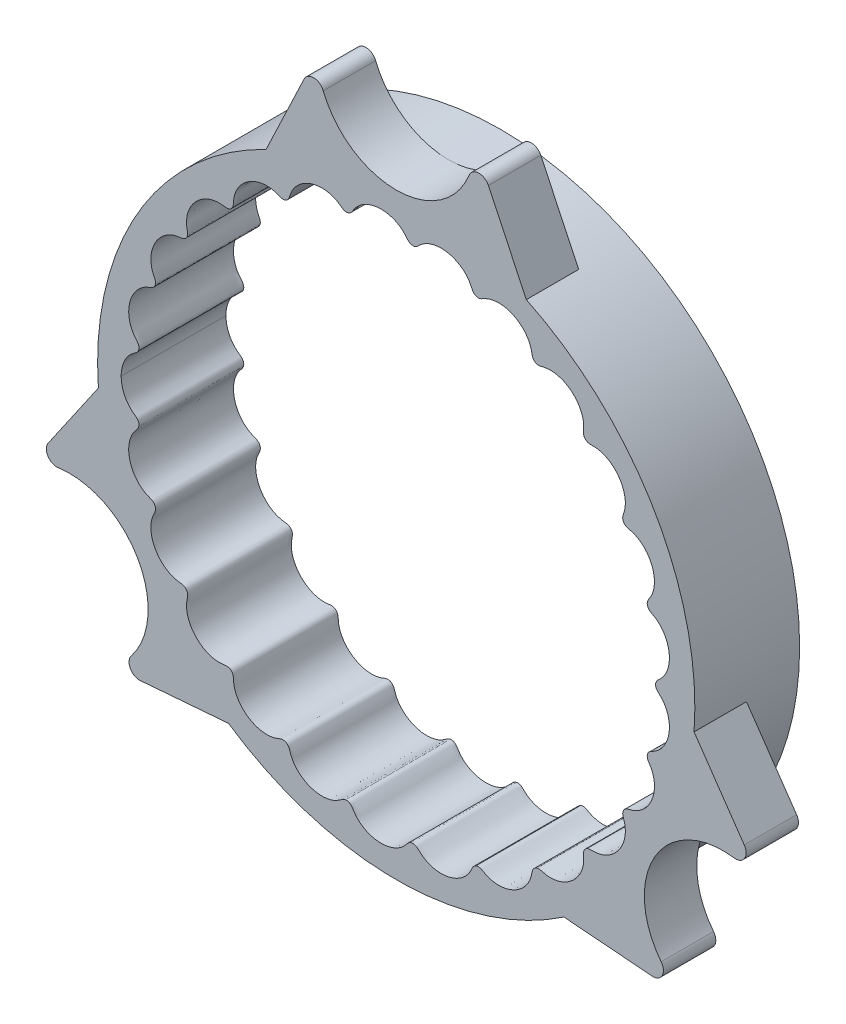
from build123d import *

# Parameters (mm, degrees)
ESQUISSE1_R        = 28.5
BOSS_EXTRU_1_DEPTH = 10
BOSS_EXTRU_2_START = -5
BOSS_EXTRU_2_DEPTH = 5


with BuildPart() as part:
    # Esquisse1 → Boss.-Extru.1 (new body)
    with BuildSketch(Plane.XY):
        Circle(ESQUISSE1_R)
        with BuildLine():
            add(Edge.make_bspline(
                [(24.75, 0), (24.75, -0.01190895), (24.750668659, -0.029768799), (24.75289752, -0.060006713), (24.758884934, -0.104774168), (24.767485304, -0.1467503), (24.785152354, -0.206071411), (24.818482478, -0.284185867), (24.880818803, -0.385919884), (24.984658612, -0.50047292), (25.114781066, -0.616600782), (25.255435339, -0.752464933), (25.419807145, -0.93333087), (25.594989864, -1.169106201), (25.768920192, -1.472936072), (25.920736133, -1.849650866), (26.023477253, -2.249860974), (26.074696747, -2.666946621), (26.073312156, -3.086313852), (26.020370658, -3.501501101), (25.917002683, -3.906273732), (25.764403676, -4.294347485), (25.566224565, -4.654785317), (25.325903213, -4.981499954), (25.081588671, -5.233067427), (24.851914535, -5.418631885), (24.667098284, -5.540217829), (24.539548747, -5.613941762), (24.410179088, -5.684594723), (24.273991814, -5.758046627), (24.120002912, -5.867762768), (23.989867, -6.050335584), (23.936355638, -6.275127193), (23.969192195, -6.495758333), (24.065351302, -6.684284012), (24.178449314, -6.851934675), (24.280144364, -7.019011908), (24.393570042, -7.235347013), (24.503436737, -7.50770452), (24.595094748, -7.84543671), (24.647032867, -8.248159789), (24.645694803, -8.661209862), (24.57595365, -9.185528563), (24.417645445, -9.696077248), (24.174741138, -10.176578568), (23.852030812, -10.610062282), (23.558837347, -10.90980476), (23.24095056, -11.157802847), (22.946586259, -11.329086722), (22.692113519, -11.440823192), (22.472657763, -11.513539342), (22.29388462, -11.561503733), (22.101259895, -11.606028638), (21.902055354, -11.681610724), (21.728453668, -11.828148656), (21.620885016, -12.038837081), (21.601595838, -12.263660858), (21.650481834, -12.469316746), (21.718254479, -12.659791435), (21.774584138, -12.84705718), (21.829677768, -13.084963879), (21.867201208, -13.376160202), (21.870688906, -13.725995236), (21.819474916, -14.128698884), (21.71419458, -14.527993453), (21.514773646, -15.017801417), (21.233133123, -15.4720736), (20.877140734, -15.876030958), (20.455657215, -16.214386724), (20.096354081, -16.430676116), (19.726170583, -16.590569736), (19.398076252, -16.68206281), (19.123633935, -16.725922166), (18.892914818, -16.74091163), (18.707848134, -16.742350192), (18.510091067, -16.737829569), (18.298399992, -16.764443666), (18.095471353, -16.866909122), (17.942147178, -17.047179332), (17.871387572, -17.261366287), (17.870202468, -17.472525416), (17.888313355, -17.673814374), (17.895669209, -17.869207586), (17.888886536, -18.113260777), (17.85168272, -18.404436203), (17.766823301, -18.743754438), (17.615819616, -19.120463832), (17.413434594, -19.48028858), (17.162321288, -19.816819375), (16.868500143, -20.122110223), (16.535786091, -20.390797243), (16.168397966, -20.617282366), (15.771042449, -20.795687849), (15.368766607, -20.914546396), (14.97017149, -20.975982916), (14.629556137, -20.981746846), (14.352921577, -20.954877105), (14.125857036, -20.911170138), (13.94640051, -20.866001244), (13.755772511, -20.812781493), (13.543469889, -20.788894817), (13.322238716, -20.84166807), (13.131407642, -20.981742865), (13.0130413, -21.173627181), (12.961818542, -21.378246364), (12.929064797, -21.57761534), (12.886990745, -21.768547341), (12.818791692, -22.002934942), (12.70930802, -22.275243379), (12.541628211, -22.582120244), (12.300626204, -22.908551746), (12.01422203, -23.205749325), (11.686582401, -23.4681837), (11.325453487, -23.689705246), (10.935854532, -23.866053147), (10.523258626, -23.992837457), (10.093696991, -24.06550579), (9.674368845, -24.079231972), (9.273085465, -24.038208914), (8.941983123, -23.957846351), (8.681067639, -23.861969077), (8.472360468, -23.762392874), (8.310008249, -23.673519219), (8.138322101, -23.574972467), (7.937182673, -23.501849574), (7.704899941, -23.502076627), (7.478095746, -23.600741865), (7.316947907, -23.77285878), (7.220831609, -23.97055906), (7.115634845, -24.203403783), (6.974300377, -24.460401189), (6.773045478, -24.737487424), (6.497851462, -25.02237666), (6.183428844, -25.270910892), (5.835740341, -25.479668636), (5.460328709, -25.645214949), (5.061542815, -25.765601822), (4.644666369, -25.83709061), (4.215744672, -25.855893135), (3.781608585, -25.818103671), (3.372294549, -25.725760832), (2.994169108, -25.584908149), (2.694109042, -25.423555897), (2.465647641, -25.264915254), (2.289085947, -25.115815571), (2.153739497, -24.989104422), (2.012318186, -24.851122457), (1.832423714, -24.733108156), (1.552983355, -24.66593755), (1.26214529, -24.754622086), (1.075414287, -24.957557798), (0.889090341, -25.194134228), (0.69672049, -25.401829912), (0.44758856, -25.61527269), (0.125683965, -25.821812182), (-0.224585626, -25.987068298), (-0.598975616, -26.109092558), (-0.990876156, -26.185347308), (-1.391941275, -26.2145582), (-1.796224618, -26.195837186), (-2.198144681, -26.128499562), (-2.591457519, -26.011923113), (-2.962803429, -25.848997421), (-3.306221845, -25.642423994), (-3.61537583, -25.39483403), (-3.850272783, -25.145621471), (-4.023133112, -24.908691884), (-4.156981332, -24.691054937), (-4.276293257, -24.506578487), (-4.456318725, -24.354528199), (-4.693068775, -24.282897531), (-4.923798246, -24.309710303), (-5.115035952, -24.406102337), (-5.273240645, -24.525178417), (-5.42301226, -24.633920894), (-5.617383402, -24.75923363), (-5.863981708, -24.887558689), (-6.182207181, -25.009385657), (-6.575059912, -25.101071531), (-6.9927825, -25.140689035), (-7.428136381, -25.123106217), (-7.851204623, -25.050059218), (-8.255644199, -24.926289526), (-8.635975215, -24.756290763), (-8.987390026, -24.544434268), (-9.305810055, -24.293211507), (-9.586131065, -24.006734367), (-9.822904508, -23.689158592), (-9.987239236, -23.388704672), (-10.094751199, -23.11580793), (-10.169610451, -22.871508954), (-10.24112571, -22.663502872), (-10.381175345, -22.473662137), (-10.594956363, -22.349311543), (-10.825624608, -22.322047042), (-11.033849204, -22.370890621), (-11.216381876, -22.447371753), (-11.388695767, -22.514940651), (-11.608352834, -22.58716666), (-11.87933894, -22.649041617), (-12.217942215, -22.68664221), (-12.621151131, -22.6763477), (-13.035301253, -22.609509201), (-13.452127793, -22.482943679), (-13.845292771, -22.304868342), (-14.20938889, -22.080540487), (-14.539531306, -21.814993299), (-14.831269767, -21.513076759), (-15.077661765, -21.181891436), (-15.275270226, -20.827454377), (-15.402577207, -20.501715906), (-15.476526159, -20.217667398), (-15.514326563, -19.976485954), (-15.531829272, -19.781749163), (-15.539202372, -19.579813227), (-15.565591069, -19.370421028), (-15.660806856, -19.1659885), (-15.83405536, -19.004717982), (-16.047591105, -18.926560558), (-16.261088064, -18.925182163), (-16.456798489, -18.954287053), (-16.640543184, -18.976331541), (-16.871307425, -18.990807395), (-17.149104778, -18.982241272), (-17.486194881, -18.933211709), (-17.873723074, -18.821638459), (-18.257615968, -18.652692803), (-18.629084532, -18.425342732), (-18.964764813, -18.15411038), (-19.260725449, -17.845401443), (-19.513475385, -17.50529118), (-19.719894943, -17.139574851), (-19.874988153, -16.756923442), (-19.976929286, -16.364037242), (-20.017953734, -16.016642642), (-20.017798024, -15.723070973), (-19.993447495, -15.480115157), (-19.96134753, -15.287225434), (-19.918054975, -15.089779832), (-19.89402871, -14.879875268), (-19.939362883, -14.658860507), (-20.070693635, -14.462043286), (-20.260249499, -14.336679591), (-20.467155514, -14.285214031), (-20.663881817, -14.2650629), (-20.847282484, -14.240161779), (-21.074211831, -14.195950386), (-21.340836688, -14.11751373), (-21.654611423, -13.985047804), (-22.001454707, -13.779432555), (-22.330360371, -13.519308084), (-22.705485211, -13.130240844), (-23.007369545, -12.684411231), (-23.229136266, -12.198075036), (-23.364819327, -11.686883469), (-23.418570267, -11.277399868), (-23.418213213, -10.871399708), (-23.370257339, -10.524800668), (-23.295965049, -10.240716159), (-23.211017087, -10.011726748), (-23.131365089, -9.833119484), (-23.040198426, -9.652618084), (-22.96715924, -9.454144986), (-22.960141523, -9.228680333), (-23.042373084, -9.007208297), (-23.198166311, -8.840665724), (-23.388940312, -8.741382585), (-23.57769294, -8.6722803), (-23.75308195, -8.599853942), (-23.966244513, -8.496298837), (-24.209343816, -8.347711506), (-24.48032477, -8.1355972), (-24.761295108, -7.846344695), (-25.008480075, -7.513349868), (-25.26655565, -7.04900195), (-25.442920247, -6.54763643), (-25.533949151, -6.025561479), (-25.536599067, -5.498854498), (-25.485486947, -5.088916426), (-25.382794666, -4.696000106), (-25.248906316, -4.372612425), (-25.105242941, -4.116427211), (-24.965170858, -3.916248887), (-24.843083512, -3.763442502), (-24.709834093, -3.611215538), (-24.591948067, -3.435387495), (-24.533798882, -3.220620895), (-24.560423715, -2.992589013), (-24.66665443, -2.797016304), (-24.822727104, -2.653701408), (-24.98966356, -2.53926073), (-25.146322188, -2.422077132), (-25.332496393, -2.263776399), (-25.502275925, -2.087254142), (-25.654526877, -1.895838833), (-25.79052351, -1.688263992), (-25.890012472, -1.511998867), (-25.978955887, -1.325507929), (-26.056614781, -1.131467198), (-26.121383307, -0.930707527), (-26.173241314, -0.729759288), (-26.207287779, -0.545661218), (-26.228372118, -0.39585777), (-26.240536879, -0.255725402), (-26.247025958, -0.16909655), (-26.249459241, -0.066739393), (-26.25, -0.022255367), (-26.25, 0)],
                knots=[0.07432085, 0.07432085, 0.07432085, 0.07432085, 0.07432085, 0.074838236, 0.075096929, 0.075355622, 0.075873009, 0.076390395, 0.077425167, 0.07845994, 0.080262761, 0.082065582, 0.083868403, 0.085671224, 0.089276866, 0.092882508, 0.096749545, 0.100616583, 0.104483621, 0.108350658, 0.112188336, 0.116026013, 0.11986369, 0.123701367, 0.12732655, 0.130951733, 0.132764324, 0.134576916, 0.135483211, 0.136389507, 0.138202099, 0.140295775, 0.142389451, 0.144458848, 0.146528245, 0.148330503, 0.150132762, 0.15193502, 0.153737278, 0.157341795, 0.160946311, 0.164812321, 0.16867833, 0.17254434, 0.180415799, 0.184421248, 0.188426697, 0.192432147, 0.195844027, 0.199255907, 0.200961848, 0.202667788, 0.204373728, 0.206079668, 0.208268892, 0.210458115, 0.21252702, 0.214595925, 0.216397713, 0.218199501, 0.220001289, 0.221803077, 0.225406654, 0.22901023, 0.232875219, 0.236740209, 0.240605199, 0.248476586, 0.252482983, 0.25648938, 0.260495777, 0.263907756, 0.267319735, 0.269025725, 0.270731714, 0.272437704, 0.274143693, 0.276335152, 0.278526612, 0.280594702, 0.282662792, 0.284464203, 0.286265613, 0.288067024, 0.289868435, 0.293471257, 0.297074079, 0.300938067, 0.304802055, 0.308666044, 0.312530032, 0.316537343, 0.320544653, 0.324551964, 0.328559274, 0.331971493, 0.335383713, 0.337089822, 0.338795932, 0.340502041, 0.342208151, 0.3444015, 0.346594848, 0.348661829, 0.35072881, 0.352529935, 0.354331061, 0.356132186, 0.357933311, 0.361535562, 0.365137813, 0.369000829, 0.372863844, 0.37672686, 0.380589876, 0.384598055, 0.388606234, 0.392614413, 0.396622592, 0.400035189, 0.403447785, 0.405154083, 0.406860381, 0.408566679, 0.410272977, 0.412467856, 0.414662735, 0.416905332, 0.41914793, 0.420947533, 0.422747136, 0.426346341, 0.429945547, 0.433544752, 0.437320979, 0.441097206, 0.444873433, 0.44864966, 0.452658654, 0.456667648, 0.460676642, 0.464685636, 0.468098738, 0.471511839, 0.473218389, 0.47492494, 0.476631491, 0.478338041, 0.480534086, 0.48273013, 0.487019518, 0.488748834, 0.49047815, 0.493936782, 0.497395414, 0.500854047, 0.504530334, 0.508206621, 0.511882908, 0.515559195, 0.519334982, 0.52311077, 0.526886557, 0.530662345, 0.534261527, 0.537860709, 0.541459892, 0.543259483, 0.545059074, 0.547300663, 0.549542252, 0.55173776, 0.553933267, 0.555639684, 0.5573461, 0.559052517, 0.560758933, 0.564171767, 0.5675846, 0.571593194, 0.575601788, 0.579610382, 0.583618976, 0.587395654, 0.591172332, 0.594949011, 0.598725689, 0.602324954, 0.605924219, 0.609523484, 0.611323117, 0.613122749, 0.615366313, 0.617609877, 0.619804036, 0.621998195, 0.623704391, 0.625410586, 0.627116782, 0.628822977, 0.632235368, 0.635647759, 0.63965551, 0.643663261, 0.647671012, 0.651678763, 0.655542261, 0.659405759, 0.663269257, 0.667132755, 0.670735268, 0.674337782, 0.676139039, 0.677940295, 0.679741552, 0.681542809, 0.683610379, 0.685677949, 0.687870397, 0.690062845, 0.691768886, 0.693474927, 0.695180968, 0.696887009, 0.700299091, 0.703711172, 0.707718031, 0.71172489, 0.715731748, 0.719738607, 0.723603093, 0.727467579, 0.731332066, 0.735196552, 0.738799727, 0.742402903, 0.744204491, 0.746006079, 0.747807667, 0.749609255, 0.751677791, 0.753746327, 0.755936711, 0.758127095, 0.75983305, 0.761539006, 0.763244962, 0.764950918, 0.76836283, 0.771774741, 0.775780668, 0.779786595, 0.783792522, 0.791663947, 0.795529445, 0.799394943, 0.803260441, 0.806864464, 0.810468487, 0.812270499, 0.81407251, 0.815874522, 0.817676533, 0.819745726, 0.821814919, 0.823998833, 0.826182748, 0.827931402, 0.829680057, 0.831428712, 0.833177366, 0.836674676, 0.840171985, 0.844093542, 0.8480151, 0.851936657, 0.859724738, 0.863591261, 0.867457784, 0.871324307, 0.874929364, 0.87853442, 0.880336948, 0.882139476, 0.883942004, 0.885744532, 0.887814048, 0.889883563, 0.891953048, 0.894022532, 0.895825669, 0.897628805, 0.899431941, 0.901235078, 0.90484135, 0.906644487, 0.908447623, 0.910381399, 0.912315175, 0.914248951, 0.916182727, 0.918116503, 0.920050278, 0.921017166, 0.921984054, 0.922950942, 0.92391783, 0.92391783, 0.92391783, 0.92391783, 0.92391783], degree=4))
            add(Edge.make_bspline(
                [(24.75, 0), (24.75, 0.01190895), (24.750668659, 0.029768799), (24.75289752, 0.060006713), (24.758884934, 0.104774168), (24.767485304, 0.1467503), (24.785152354, 0.206071411), (24.818482478, 0.284185867), (24.880818803, 0.385919884), (24.984658612, 0.50047292), (25.114781066, 0.616600782), (25.255435339, 0.752464933), (25.419807145, 0.93333087), (25.594989864, 1.169106201), (25.768920192, 1.472936072), (25.920736133, 1.849650866), (26.023477253, 2.249860974), (26.074696747, 2.666946621), (26.073312156, 3.086313852), (26.020370658, 3.501501101), (25.917002683, 3.906273732), (25.764403676, 4.294347485), (25.566224565, 4.654785317), (25.325903213, 4.981499954), (25.081588671, 5.233067427), (24.851914535, 5.418631885), (24.667098284, 5.540217829), (24.539548747, 5.613941762), (24.410179088, 5.684594723), (24.273991814, 5.758046627), (24.120002912, 5.867762768), (23.989867, 6.050335584), (23.936355638, 6.275127193), (23.969192195, 6.495758333), (24.065351302, 6.684284012), (24.178449314, 6.851934675), (24.280144364, 7.019011908), (24.393570042, 7.235347013), (24.503436737, 7.50770452), (24.595094748, 7.84543671), (24.647032867, 8.248159789), (24.645694803, 8.661209862), (24.57595365, 9.185528563), (24.417645445, 9.696077248), (24.174741138, 10.176578568), (23.852030812, 10.610062282), (23.558837347, 10.90980476), (23.24095056, 11.157802847), (22.946586259, 11.329086722), (22.692113519, 11.440823192), (22.472657763, 11.513539342), (22.29388462, 11.561503733), (22.101259895, 11.606028638), (21.902055354, 11.681610724), (21.728453668, 11.828148656), (21.620885016, 12.038837081), (21.601595838, 12.263660858), (21.650481834, 12.469316746), (21.718254479, 12.659791435), (21.774584138, 12.84705718), (21.829677768, 13.084963879), (21.867201208, 13.376160202), (21.870688906, 13.725995236), (21.819474916, 14.128698884), (21.71419458, 14.527993453), (21.514773646, 15.017801417), (21.233133123, 15.4720736), (20.877140734, 15.876030958), (20.455657215, 16.214386724), (20.096354081, 16.430676116), (19.726170583, 16.590569736), (19.398076252, 16.68206281), (19.123633935, 16.725922166), (18.892914818, 16.74091163), (18.707848134, 16.742350192), (18.510091067, 16.737829569), (18.298399992, 16.764443666), (18.095471353, 16.866909122), (17.942147178, 17.047179332), (17.871387572, 17.261366287), (17.870202468, 17.472525416), (17.888313355, 17.673814374), (17.895669209, 17.869207586), (17.888886536, 18.113260777), (17.85168272, 18.404436203), (17.766823301, 18.743754438), (17.615819616, 19.120463832), (17.413434594, 19.48028858), (17.162321288, 19.816819375), (16.868500143, 20.122110223), (16.535786091, 20.390797243), (16.168397966, 20.617282366), (15.771042449, 20.795687849), (15.368766607, 20.914546396), (14.97017149, 20.975982916), (14.629556137, 20.981746846), (14.352921577, 20.954877105), (14.125857036, 20.911170138), (13.94640051, 20.866001244), (13.755772511, 20.812781493), (13.543469889, 20.788894817), (13.322238716, 20.84166807), (13.131407642, 20.981742865), (13.0130413, 21.173627181), (12.961818542, 21.378246364), (12.929064797, 21.57761534), (12.886990745, 21.768547341), (12.818791692, 22.002934942), (12.70930802, 22.275243379), (12.541628211, 22.582120244), (12.300626204, 22.908551746), (12.01422203, 23.205749325), (11.686582401, 23.4681837), (11.325453487, 23.689705246), (10.935854532, 23.866053147), (10.523258626, 23.992837457), (10.093696991, 24.06550579), (9.674368845, 24.079231972), (9.273085465, 24.038208914), (8.941983123, 23.957846351), (8.681067639, 23.861969077), (8.472360468, 23.762392874), (8.310008249, 23.673519219), (8.138322101, 23.574972467), (7.937182673, 23.501849574), (7.704899941, 23.502076627), (7.478095746, 23.600741865), (7.316947907, 23.772858779), (7.220831609, 23.97055906), (7.115634845, 24.203403783), (6.974300377, 24.460401189), (6.773045477, 24.737487424), (6.497851462, 25.02237666), (6.183428844, 25.270910892), (5.835740341, 25.479668636), (5.460328709, 25.645214949), (5.061542815, 25.765601822), (4.644666369, 25.83709061), (4.215744672, 25.855893135), (3.781608585, 25.818103671), (3.372294549, 25.725760832), (2.994169108, 25.584908149), (2.694109042, 25.423555897), (2.465647641, 25.264915254), (2.289085947, 25.115815571), (2.153739497, 24.989104422), (2.012318186, 24.851122457), (1.832423714, 24.733108156), (1.552983354, 24.66593755), (1.26214529, 24.754622086), (1.075414287, 24.957557798), (0.889090341, 25.194134228), (0.69672049, 25.401829912), (0.44758856, 25.61527269), (0.125683965, 25.821812182), (-0.224585626, 25.987068298), (-0.598975616, 26.109092558), (-0.990876156, 26.185347308), (-1.391941275, 26.2145582), (-1.796224618, 26.195837186), (-2.198144681, 26.128499562), (-2.591457519, 26.011923113), (-2.962803429, 25.848997421), (-3.306221845, 25.642423994), (-3.61537583, 25.39483403), (-3.850272783, 25.145621471), (-4.023133112, 24.908691884), (-4.156981332, 24.691054937), (-4.276293257, 24.506578487), (-4.456318725, 24.354528199), (-4.693068775, 24.282897531), (-4.923798246, 24.309710303), (-5.115035952, 24.406102337), (-5.273240646, 24.525178417), (-5.42301226, 24.633920894), (-5.617383402, 24.75923363), (-5.863981708, 24.887558689), (-6.182207181, 25.009385657), (-6.575059912, 25.101071531), (-6.9927825, 25.140689035), (-7.428136381, 25.123106217), (-7.851204623, 25.050059218), (-8.255644199, 24.926289526), (-8.635975215, 24.756290763), (-8.987390026, 24.544434268), (-9.305810055, 24.293211507), (-9.586131065, 24.006734367), (-9.822904508, 23.689158592), (-9.987239236, 23.388704672), (-10.094751199, 23.11580793), (-10.169610451, 22.871508954), (-10.24112571, 22.663502872), (-10.381175345, 22.473662137), (-10.594956363, 22.349311543), (-10.825624608, 22.322047042), (-11.033849204, 22.370890621), (-11.216381876, 22.447371753), (-11.388695767, 22.514940651), (-11.608352834, 22.58716666), (-11.87933894, 22.649041617), (-12.217942215, 22.68664221), (-12.621151131, 22.676347699), (-13.035301253, 22.609509201), (-13.452127793, 22.482943679), (-13.845292771, 22.304868342), (-14.20938889, 22.080540487), (-14.539531306, 21.814993299), (-14.831269767, 21.513076759), (-15.077661765, 21.181891436), (-15.275270226, 20.827454377), (-15.402577207, 20.501715906), (-15.476526159, 20.217667398), (-15.514326563, 19.976485954), (-15.531829272, 19.781749163), (-15.539202372, 19.579813227), (-15.565591069, 19.370421028), (-15.660806856, 19.1659885), (-15.83405536, 19.004717982), (-16.047591105, 18.926560558), (-16.261088064, 18.925182163), (-16.456798489, 18.954287053), (-16.640543184, 18.976331541), (-16.871307425, 18.990807395), (-17.149104778, 18.982241272), (-17.486194881, 18.933211709), (-17.873723074, 18.821638459), (-18.257615968, 18.652692802), (-18.629084532, 18.425342732), (-18.964764813, 18.15411038), (-19.260725449, 17.845401443), (-19.513475385, 17.50529118), (-19.719894943, 17.139574851), (-19.874988153, 16.756923442), (-19.976929286, 16.364037242), (-20.017953734, 16.016642642), (-20.017798024, 15.723070973), (-19.993447495, 15.480115157), (-19.96134753, 15.287225434), (-19.918054975, 15.089779832), (-19.89402871, 14.879875268), (-19.939362883, 14.658860507), (-20.070693635, 14.462043286), (-20.260249499, 14.336679591), (-20.467155514, 14.285214031), (-20.663881817, 14.2650629), (-20.847282484, 14.240161779), (-21.074211831, 14.195950386), (-21.340836688, 14.11751373), (-21.654611423, 13.985047804), (-22.001454707, 13.779432555), (-22.330360371, 13.519308084), (-22.705485211, 13.130240844), (-23.007369545, 12.684411231), (-23.229136266, 12.198075036), (-23.364819327, 11.686883469), (-23.418570267, 11.277399868), (-23.418213213, 10.871399708), (-23.370257339, 10.524800667), (-23.295965049, 10.240716159), (-23.211017087, 10.011726748), (-23.131365089, 9.833119484), (-23.040198426, 9.652618084), (-22.96715924, 9.454144986), (-22.960141523, 9.228680333), (-23.042373084, 9.007208297), (-23.198166311, 8.840665724), (-23.388940312, 8.741382585), (-23.57769294, 8.6722803), (-23.75308195, 8.599853942), (-23.966244513, 8.496298837), (-24.209343816, 8.347711506), (-24.48032477, 8.1355972), (-24.761295108, 7.846344695), (-25.008480075, 7.513349868), (-25.26655565, 7.04900195), (-25.442920247, 6.54763643), (-25.533949151, 6.025561479), (-25.536599067, 5.498854498), (-25.485486947, 5.088916426), (-25.382794666, 4.696000106), (-25.248906316, 4.372612425), (-25.105242941, 4.116427211), (-24.965170858, 3.916248887), (-24.843083512, 3.763442502), (-24.709834093, 3.611215538), (-24.591948067, 3.435387495), (-24.533798882, 3.220620895), (-24.560423715, 2.992589013), (-24.66665443, 2.797016303), (-24.822727104, 2.653701408), (-24.98966356, 2.53926073), (-25.146322188, 2.422077132), (-25.332496393, 2.263776399), (-25.502275925, 2.087254142), (-25.654526877, 1.895838833), (-25.79052351, 1.688263992), (-25.890012472, 1.511998867), (-25.978955887, 1.325507929), (-26.056614781, 1.131467198), (-26.121383307, 0.930707527), (-26.173241314, 0.729759288), (-26.207287779, 0.545661218), (-26.228372118, 0.39585777), (-26.240536879, 0.255725402), (-26.247025958, 0.16909655), (-26.249459241, 0.066739393), (-26.25, 0.022255367), (-26.25, 0)],
                knots=[0.07432085, 0.07432085, 0.07432085, 0.07432085, 0.07432085, 0.074838236, 0.075096929, 0.075355622, 0.075873009, 0.076390395, 0.077425167, 0.07845994, 0.080262761, 0.082065582, 0.083868403, 0.085671224, 0.089276866, 0.092882508, 0.096749545, 0.100616583, 0.104483621, 0.108350658, 0.112188336, 0.116026013, 0.11986369, 0.123701367, 0.12732655, 0.130951733, 0.132764324, 0.134576916, 0.135483211, 0.136389507, 0.138202099, 0.140295775, 0.142389451, 0.144458848, 0.146528245, 0.148330503, 0.150132762, 0.15193502, 0.153737278, 0.157341795, 0.160946311, 0.164812321, 0.16867833, 0.17254434, 0.180415799, 0.184421248, 0.188426697, 0.192432147, 0.195844027, 0.199255907, 0.200961848, 0.202667788, 0.204373728, 0.206079668, 0.208268892, 0.210458115, 0.21252702, 0.214595925, 0.216397713, 0.218199501, 0.220001289, 0.221803077, 0.225406654, 0.22901023, 0.232875219, 0.236740209, 0.240605199, 0.248476586, 0.252482983, 0.25648938, 0.260495777, 0.263907756, 0.267319735, 0.269025725, 0.270731714, 0.272437704, 0.274143693, 0.276335152, 0.278526612, 0.280594702, 0.282662792, 0.284464203, 0.286265613, 0.288067024, 0.289868435, 0.293471257, 0.297074079, 0.300938067, 0.304802055, 0.308666044, 0.312530032, 0.316537343, 0.320544653, 0.324551964, 0.328559274, 0.331971493, 0.335383713, 0.337089822, 0.338795932, 0.340502041, 0.342208151, 0.3444015, 0.346594848, 0.348661829, 0.35072881, 0.352529935, 0.354331061, 0.356132186, 0.357933311, 0.361535562, 0.365137813, 0.369000829, 0.372863844, 0.37672686, 0.380589876, 0.384598055, 0.388606234, 0.392614413, 0.396622592, 0.400035189, 0.403447785, 0.405154083, 0.406860381, 0.408566679, 0.410272977, 0.412467856, 0.414662735, 0.416905332, 0.41914793, 0.420947533, 0.422747136, 0.426346341, 0.429945547, 0.433544752, 0.437320979, 0.441097206, 0.444873433, 0.44864966, 0.452658654, 0.456667648, 0.460676642, 0.464685636, 0.468098738, 0.471511839, 0.473218389, 0.47492494, 0.476631491, 0.478338041, 0.480534086, 0.48273013, 0.487019518, 0.488748834, 0.49047815, 0.493936782, 0.497395414, 0.500854047, 0.504530334, 0.508206621, 0.511882908, 0.515559195, 0.519334982, 0.52311077, 0.526886557, 0.530662345, 0.534261527, 0.537860709, 0.541459892, 0.543259483, 0.545059074, 0.547300663, 0.549542252, 0.55173776, 0.553933267, 0.555639684, 0.5573461, 0.559052517, 0.560758933, 0.564171767, 0.5675846, 0.571593194, 0.575601788, 0.579610382, 0.583618976, 0.587395654, 0.591172332, 0.594949011, 0.598725689, 0.602324954, 0.605924219, 0.609523484, 0.611323117, 0.613122749, 0.615366313, 0.617609877, 0.619804036, 0.621998195, 0.623704391, 0.625410586, 0.627116782, 0.628822977, 0.632235368, 0.635647759, 0.63965551, 0.643663261, 0.647671012, 0.651678763, 0.655542261, 0.659405759, 0.663269257, 0.667132755, 0.670735268, 0.674337782, 0.676139039, 0.677940295, 0.679741552, 0.681542809, 0.683610379, 0.685677949, 0.687870397, 0.690062845, 0.691768886, 0.693474927, 0.695180968, 0.696887009, 0.700299091, 0.703711172, 0.707718031, 0.71172489, 0.715731748, 0.719738607, 0.723603093, 0.727467579, 0.731332066, 0.735196552, 0.738799727, 0.742402903, 0.744204491, 0.746006079, 0.747807667, 0.749609255, 0.751677791, 0.753746327, 0.755936711, 0.758127095, 0.75983305, 0.761539006, 0.763244962, 0.764950918, 0.76836283, 0.771774741, 0.775780668, 0.779786595, 0.783792522, 0.791663947, 0.795529445, 0.799394943, 0.803260441, 0.806864464, 0.810468487, 0.812270499, 0.81407251, 0.815874522, 0.817676533, 0.819745726, 0.821814919, 0.823998833, 0.826182748, 0.827931402, 0.829680057, 0.831428712, 0.833177366, 0.836674676, 0.840171985, 0.844093542, 0.8480151, 0.851936657, 0.859724738, 0.863591261, 0.867457784, 0.871324307, 0.874929364, 0.87853442, 0.880336948, 0.882139476, 0.883942004, 0.885744532, 0.887814048, 0.889883563, 0.891953048, 0.894022532, 0.895825669, 0.897628805, 0.899431941, 0.901235078, 0.90484135, 0.906644487, 0.908447623, 0.910381399, 0.912315175, 0.914248951, 0.916182727, 0.918116503, 0.920050278, 0.921017166, 0.921984054, 0.922950942, 0.92391783, 0.92391783, 0.92391783, 0.92391783, 0.92391783], degree=4))
        make_face(mode=Mode.SUBTRACT)
    extrude(amount=BOSS_EXTRU_1_DEPTH)

    # Esquisse2 → Boss.-Extru.2 (add)
    with BuildSketch(Plane.XY.offset(10).offset(BOSS_EXTRU_2_START)):
        with BuildLine():
            ThreePointArc((-6.964024098, 33.215692481), (-7.860901458, 33.843950201), (-8.795741246, 33.273712239))
            Line((-8.795741246, 33.273712239), (-12.417994406, 25.652356908))
            ThreePointArc((-12.417994406, 25.652356908), (-6.370158084, 27.778968411), (6e-09, 28.5))
            ThreePointArc((6e-09, 28.5), (-4.205216615, 29.789834687), (-6.964024098, 33.215692481))
        make_face()
        with BuildLine():
            ThreePointArc((6.964024098, 33.215692481), (4.20521662, 29.78983469), (6e-09, 28.5))
            ThreePointArc((6e-09, 28.5), (6.37015809, 27.77896841), (12.417994406, 25.652356908))
            Line((12.417994406, 25.652356908), (8.795741246, 33.273712239))
            ThreePointArc((8.795741246, 33.273712239), (7.860901458, 33.843950201), (6.964024098, 33.215692481))
        make_face()
        with BuildLine():
            Line((33.213750701, -9.019520755), (28.424589952, -2.071879835))
            ThreePointArc((28.424589952, -2.071879835), (27.242371409, -8.372765374), (24.681724113, -14.249999817))
            ThreePointArc((24.681724113, -14.249999817), (27.901362019, -11.253092879), (32.247645542, -10.576824459))
            ThreePointArc((32.247645542, -10.576824459), (33.240171367, -10.114234741), (33.213750701, -9.019520755))
        make_face()
        with BuildLine():
            ThreePointArc((24.681724113, -14.249999817), (20.872213362, -19.406202858), (16.006595547, -23.580477073))
            Line((16.006595547, -23.580477073), (24.418009454, -24.254191484))
            ThreePointArc((24.418009454, -24.254191484), (25.379269909, -23.72971546), (25.283621444, -22.638868022))
            ThreePointArc((25.283621444, -22.638868022), (23.696145298, -18.536741659), (24.681724113, -14.249999817))
        make_face()
        with BuildLine():
            ThreePointArc((-16.006595547, -23.580477073), (-20.872213244, -19.406202985), (-24.68172394, -14.250000118))
            ThreePointArc((-24.68172394, -14.250000118), (-23.696145311, -18.536741832), (-25.283621444, -22.638868022))
            ThreePointArc((-25.283621444, -22.638868022), (-25.379269909, -23.72971546), (-24.418009454, -24.254191484))
            Line((-24.418009454, -24.254191484), (-16.006595547, -23.580477073))
        make_face()
        with BuildLine():
            ThreePointArc((-24.68172394, -14.250000118), (-27.242371358, -8.37276554), (-28.424589952, -2.071879835))
            Line((-28.424589952, -2.071879835), (-33.213750701, -9.019520755))
            ThreePointArc((-33.213750701, -9.019520755), (-33.240171367, -10.114234741), (-32.247645542, -10.576824459))
            ThreePointArc((-32.247645542, -10.576824459), (-27.901361862, -11.253092954), (-24.68172394, -14.250000118))
        make_face()
    extrude(amount=BOSS_EXTRU_2_DEPTH)


solid = part.part
